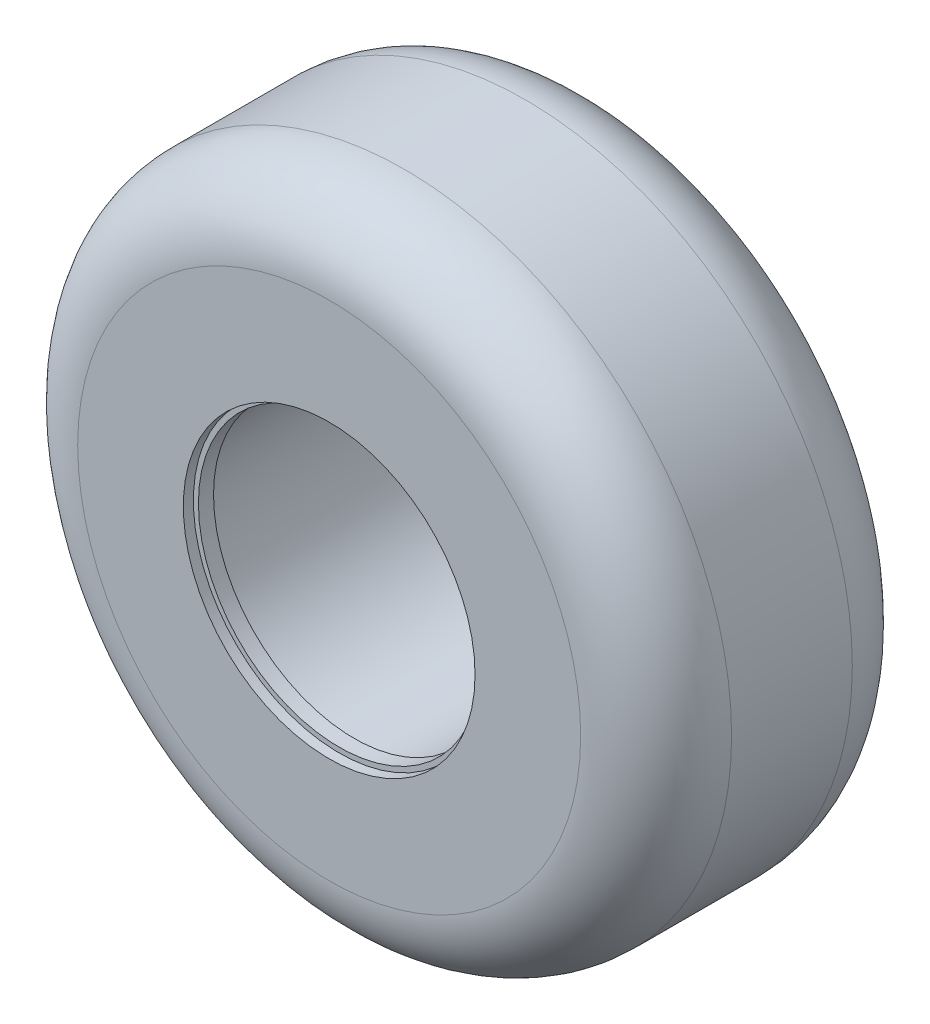
from build123d import *

# Parameters (mm, degrees)
SKETCH_1_R          = 65
SKETCH_1_R_2        = 28
EXTRUDE_1_DEPTH     = 54
SKETCH_2_R          = 29
CUT_EXTRUDE_1_DEPTH = 2
CUT_EXTRUDE_START   = -2
SKETCH_3_R          = 29
CUT_EXTRUDE_2_DEPTH = 2
SKETCH_4_W          = 1
SKETCH_4_H          = 44
FILLET_1_R          = 15


with BuildPart() as part:
    # 草图1 → 凸台-拉伸1 (new body)
    with BuildSketch(Plane.XY):
        Circle(SKETCH_1_R)
        Circle(SKETCH_1_R_2, mode=Mode.SUBTRACT)
    extrude(amount=EXTRUDE_1_DEPTH)

    # 草图2 → 切除-拉伸1 (cut)
    with BuildSketch(Plane(origin=(0, 0, 0), x_dir=(-1, 0, 0), z_dir=(0, 0, -1))):
        Circle(SKETCH_2_R)
    extrude(amount=-CUT_EXTRUDE_1_DEPTH, mode=Mode.SUBTRACT)

    # 草图3 → 切除-拉伸2 (cut)
    with BuildSketch(Plane.XY.offset(54).offset(CUT_EXTRUDE_START)):
        with Locations(Location((0, 0, 0), (0, 0, 180))):
            Circle(SKETCH_3_R)
    extrude(amount=CUT_EXTRUDE_2_DEPTH, mode=Mode.SUBTRACT)

    # 草图4 → 切除-旋转1 (revolve, cut)
    with BuildSketch(Plane(origin=(0, 0, 0), x_dir=(1, 0, 0), z_dir=(0, 1, 0))):
        with Locations((-28.017381105, -27)):
            Rectangle(SKETCH_4_W, SKETCH_4_H)
    revolve(axis=Axis((0, 0, 0), (0, 0, 1)), mode=Mode.SUBTRACT)

    # 圆角1
    fillet_1_edges = [part.edges().sort_by_distance(p)[0] for p in [
        (-65, 0, 0),
        (-65, 0, 54),
    ]]
    fillet(fillet_1_edges, radius=FILLET_1_R)


solid = part.part
